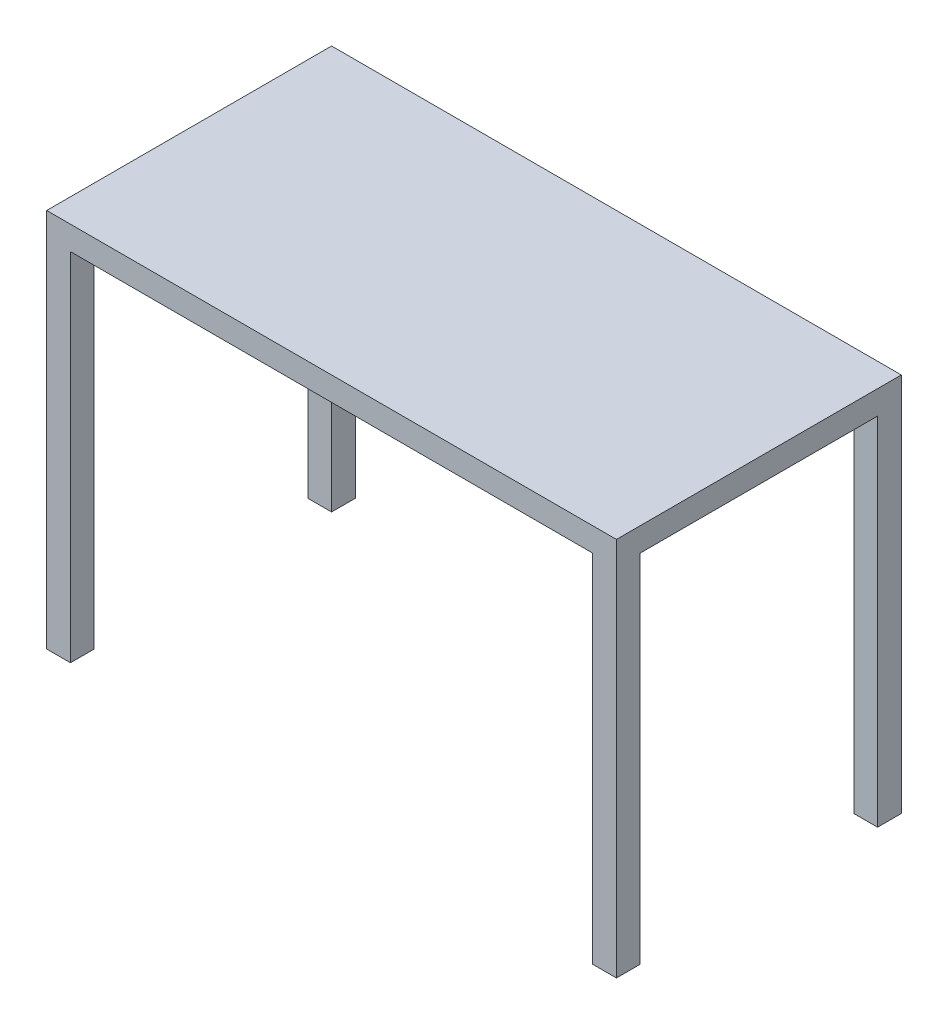
from build123d import *

# Parameters (mm, degrees)
SKETCH1_W           = 1828.8
SKETCH1_H           = 609.6
BOSS_EXTRUDE1_DEPTH = 50.8
SKETCH2_W           = 50.8
SKETCH2_H           = 50.8
BOSS_EXTRUDE2_DEPTH = 762
SKETCH3_W           = 609.6
SKETCH3_H           = 812.8
CUT_EXTRUDE1_DEPTH  = 1338.304572639
SKETCH4_W           = 50.8
SKETCH4_H           = 50.8
BOSS_EXTRUDE3_DEPTH = 762


with BuildPart() as part:
    # Sketch1 → Boss-Extrude1 (new body)
    with BuildSketch(Plane(origin=(0, 0, 0), x_dir=(1, 0, 0), z_dir=(0, 1, 0))):
        Rectangle(SKETCH1_W, SKETCH1_H)
    extrude(amount=BOSS_EXTRUDE1_DEPTH)

    # Sketch2 → Boss-Extrude2 (add)
    with BuildSketch(Plane.XZ):
        with Locations((-889, 279.4)):
            Rectangle(SKETCH2_W, SKETCH2_H)
        with Locations((-889, -279.4)):
            Rectangle(SKETCH2_W, SKETCH2_H)
        with Locations((889, 279.4)):
            Rectangle(SKETCH2_W, SKETCH2_H)
        with Locations((889, -279.4)):
            Rectangle(SKETCH2_W, SKETCH2_H)
    extrude(amount=BOSS_EXTRUDE2_DEPTH)

    # Sketch3 → Cut-Extrude1 (cut, through all)
    with BuildSketch(Plane.XY.offset(304.8)):
        with Locations((609.6, -355.6)):
            Rectangle(SKETCH3_W, SKETCH3_H)
    extrude(amount=-CUT_EXTRUDE1_DEPTH, mode=Mode.SUBTRACT)

    # Sketch4 → Boss-Extrude3 (add)
    with BuildSketch(Plane.XZ):
        with Locations((279.4, 279.4)):
            Rectangle(SKETCH4_W, SKETCH4_H)
        with Locations((279.4, -279.4)):
            Rectangle(SKETCH4_W, SKETCH4_H)
    extrude(amount=BOSS_EXTRUDE3_DEPTH)


solid = part.part
